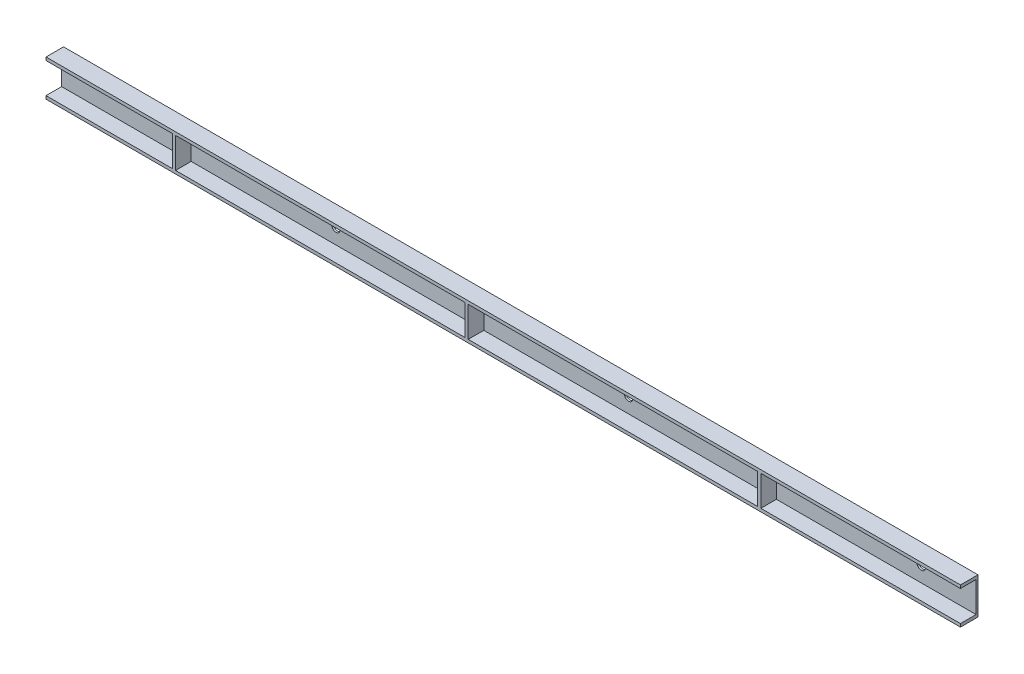
from build123d import *

# Parameters (mm, degrees)
SKETCH_1_W             = 4300
SKETCH_1_H             = 100
EXTRUDE_1_DEPTH        = 48
SKETCH_2_W             = 4300
SKETCH_2_H             = 83
CUT_EXTRUDE_2_DEPTH    = 42.7
SKETCH_3_W             = 8.5
SKETCH_3_H             = 83
EXTRUDE_3_DEPTH        = 42.7
PATTERN_LINEAR_1_COUNT = 5
PATTERN_LINEAR_1_PITCH = 800
SKETCH_4_R             = 11.5
CUT_EXTRUDE_4_DEPTH    = 4302.430459742
PATTERN_LINEAR_2_COUNT = 6
PATTERN_LINEAR_2_PITCH = 800
SKETCH_5_W             = 1800
SKETCH_5_H             = 100
CUT_EXTRUDE_1_DEPTH    = 48


with BuildPart() as part:
    # 草图1 → 拉伸1 (new body)
    with BuildSketch(Plane.XY):
        with Locations((2150, 50)):
            Rectangle(SKETCH_1_W, SKETCH_1_H)
    extrude(amount=EXTRUDE_1_DEPTH)

    # 草图2 → 拉伸2 (cut)
    with BuildSketch(Plane.XY.offset(48)):
        with Locations((2150, 50)):
            Rectangle(SKETCH_2_W, SKETCH_2_H)
    extrude(amount=-CUT_EXTRUDE_2_DEPTH, mode=Mode.SUBTRACT)

    # 草图3 → 拉伸3 (add)
    with BuildSketch(Plane.XY.offset(5.3)):
        with Locations((550, 50)):
            Rectangle(SKETCH_3_W, SKETCH_3_H)
    extrude_3 = extrude(amount=EXTRUDE_3_DEPTH)

    # 阵列(线性)1: 拉伸3 ×5
    with Locations(*[(i * PATTERN_LINEAR_1_PITCH, 0, 0) for i in range(1, PATTERN_LINEAR_1_COUNT)]):
        add(extrude_3)

    # 草图4 → 拉伸4 (cut, through all)
    with BuildSketch(Plane(origin=(0, 0, 0), x_dir=(-1, 0, 0), z_dir=(0, 0, -1))):
        with Locations((-4150, 50)):
            Circle(SKETCH_4_R)
    cut_extrude_4 = extrude(amount=-CUT_EXTRUDE_4_DEPTH, mode=Mode.SUBTRACT)

    # 阵列(线性)2: 拉伸4 ×6
    with Locations(*[(-i * PATTERN_LINEAR_2_PITCH, 0, 0) for i in range(1, PATTERN_LINEAR_2_COUNT)]):
        add(cut_extrude_4, mode=Mode.SUBTRACT)

    # 草图5 → 切除-拉伸1 (cut)
    with BuildSketch(Plane(origin=(0, 0, 0), x_dir=(-1, 0, 0), z_dir=(0, 0, -1))):
        with Locations((-900, 50)):
            Rectangle(SKETCH_5_W, SKETCH_5_H)
    extrude(amount=-CUT_EXTRUDE_1_DEPTH, mode=Mode.SUBTRACT)


solid = part.part
